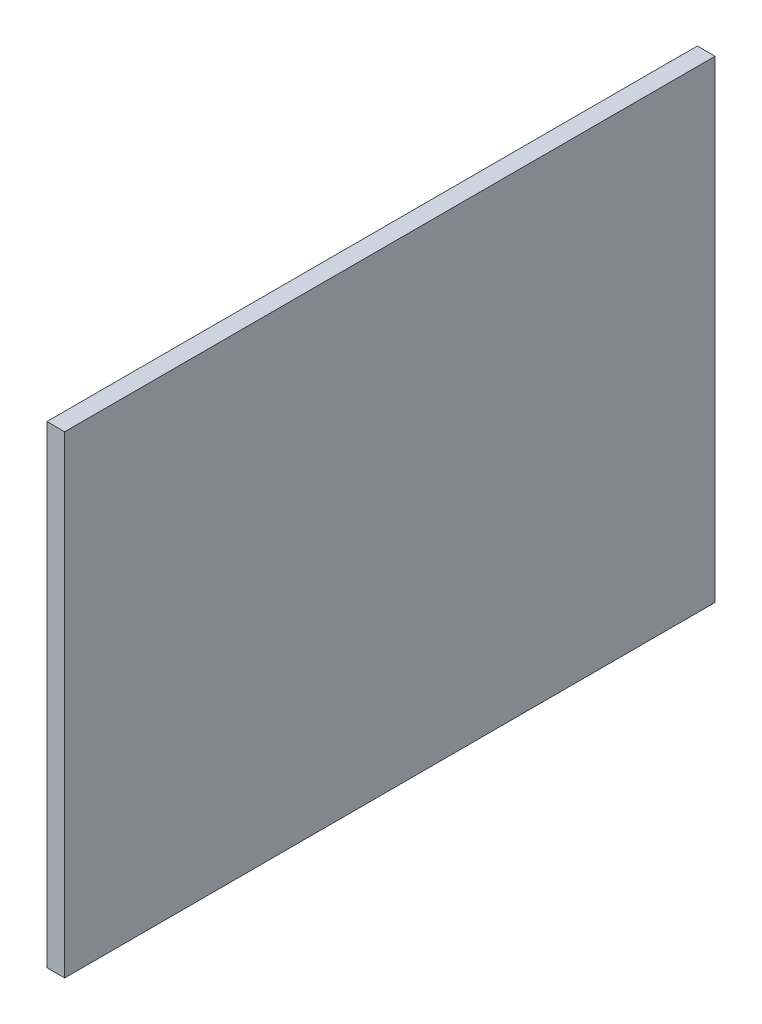
from build123d import *

# Parameters (mm, degrees)
SKETCH1_W           = 110
SKETCH1_H           = 80
BOSS_EXTRUDE1_DEPTH = 3


with BuildPart() as part:
    # Sketch1 → Boss-Extrude1 (new body)
    with BuildSketch(Plane(origin=(0, 0, 0), x_dir=(0, 0, -1), z_dir=(1, 0, 0))):
        with Locations((18.797468354, -22.776498752)):
            Rectangle(SKETCH1_W, SKETCH1_H)
    extrude(amount=BOSS_EXTRUDE1_DEPTH)


solid = part.part
